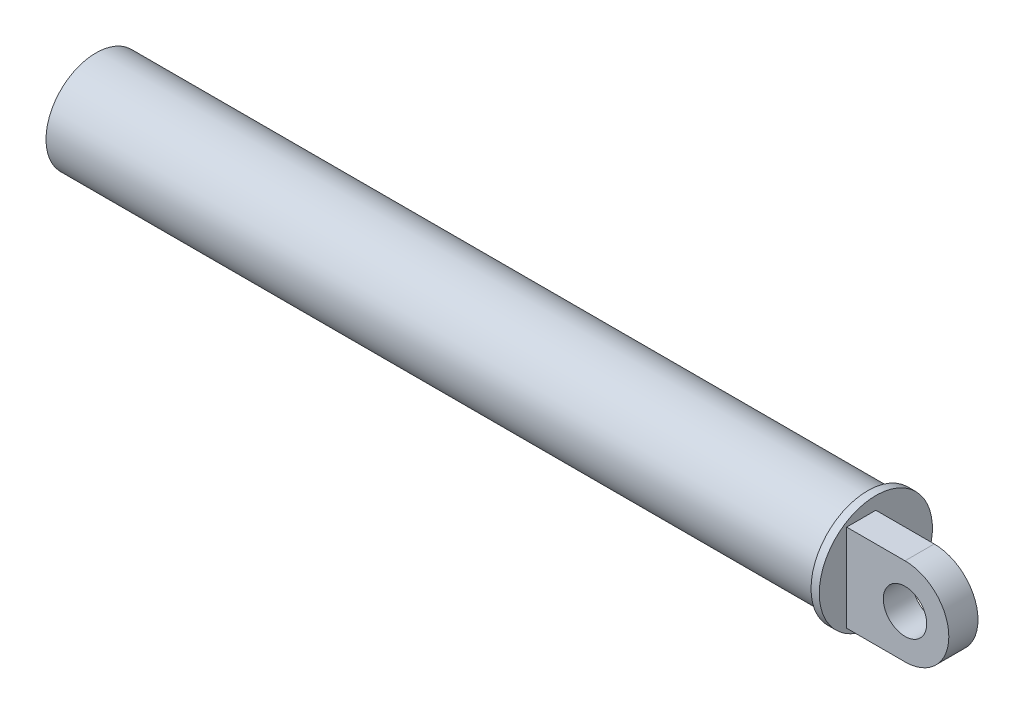
from build123d import *

# Parameters (mm, degrees)
SKETCH1_R           = 7.439633922
BOSS_EXTRUDE1_DEPTH = 10


with BuildPart() as part:
    # Sketch1 → Boss-Extrude1 (new body)
    with BuildSketch(Plane.XY):
        with BuildLine():
            Line((333.85321321, 48.612982521), (353.85321321, 48.612982521))
            ThreePointArc((353.85321321, 48.612982521), (368.85321321, 33.612982521), (353.85321321, 18.612982521))
            Line((353.85321321, 18.612982521), (333.85321321, 18.612982521))
            Line((333.85321321, 18.612982521), (333.85321321, 48.612982521))
        make_face()
        with Locations((353.85321321, 33.612982521)):
            Circle(SKETCH1_R, mode=Mode.SUBTRACT)
    extrude(amount=BOSS_EXTRUDE1_DEPTH)

    # Sketch2 → Revolve2 (revolve)
    with BuildSketch(Plane.XY, mode=Mode.PRIVATE) as revolve2_sk:
        Polygon((333.85321321, 48.612982521), (333.85321321, 52.993606974), (331.026376732, 52.993606974), (331.026376732, 50.74274425), (66.67110802, 50.74274425), (66.67110802, 42.299173429), (318.559263149, 42.299173429), (318.559263149, 33.612982521), (333.85321321, 33.612982521), align=None)
    revolve(revolve2_sk.sketch.rotate(Axis((318.559263149, 33.612982521, 0), (1, 0, 0)), 90), axis=Axis((318.559263149, 33.612982521, 0), (1, 0, 0)))


solid = part.part
